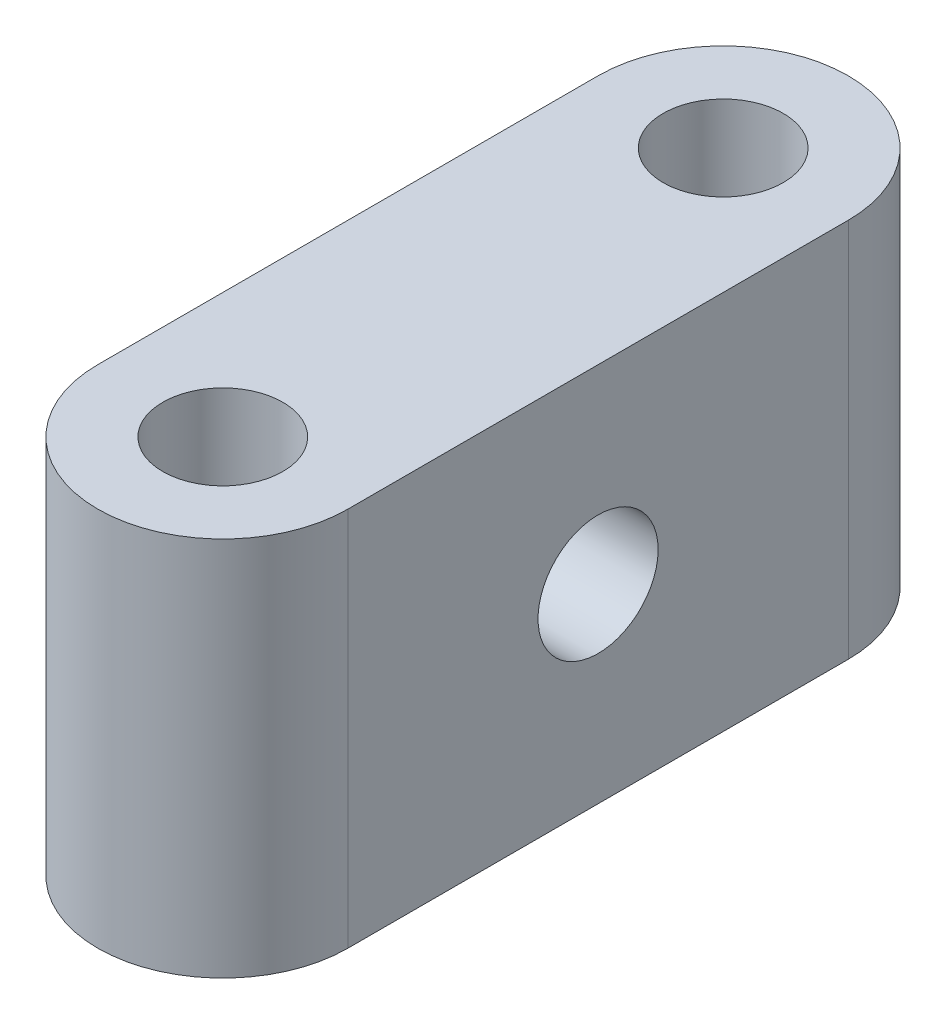
from build123d import *

# Parameters (mm, degrees)
SKETCH1_R           = 6
BOSS_EXTRUDE1_DEPTH = 19
SKETCH2_R           = 6
CUT_EXTRUDE1_DEPTH  = 12.5


with BuildPart() as part:
    # Sketch1 → Boss-Extrude1 (new, symmetric)
    with BuildSketch(Plane(origin=(0, 0, 0), x_dir=(1, 0, 0), z_dir=(0, 1, 0))):
        with BuildLine():
            Line((-12.5, 0), (-12.5, 50))
            ThreePointArc((-12.5, 50), (0, 62.5), (12.5, 50))
            Line((12.5, 50), (12.5, 0))
            ThreePointArc((12.5, 0), (0, -12.5), (-12.5, 0))
        make_face()
        with Locations(Location((0, 50, 0), (0, 0, 270))):
            Circle(SKETCH1_R, mode=Mode.SUBTRACT)
        with Locations(Location((0, 0, 0), (0, 0, 270))):
            Circle(SKETCH1_R, mode=Mode.SUBTRACT)
    extrude(amount=BOSS_EXTRUDE1_DEPTH, both=True)

    # Sketch2 → Cut-Extrude1 (cut)
    with BuildSketch(Plane(origin=(12.5, 0, 0), x_dir=(0, 0, -1), z_dir=(1, 0, 0))):
        with Locations((25, 0)):
            Circle(SKETCH2_R)
    extrude(amount=-CUT_EXTRUDE1_DEPTH, mode=Mode.SUBTRACT)


solid = part.part
